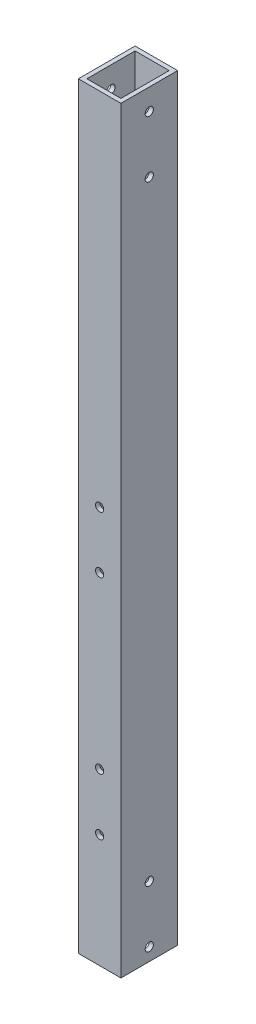
from build123d import *

# Parameters (mm, degrees)
SKETCH_1_W          = 15
SKETCH_1_H          = 20
SKETCH_1_W_2        = 12
SKETCH_1_H_2        = 17
EXTRUDE_1_DEPTH     = 267
SKETCH_4_R          = 1.45
CUT_EXTRUDE_2_DEPTH = 268.607922155
SKETCH_5_R          = 1.45
CUT_EXTRUDE_3_DEPTH = 268.853038064


with BuildPart() as part:
    # 草图1 → 拉伸-薄壁1 (new body)
    with BuildSketch(Plane(origin=(0, 0, 0), x_dir=(1, 0, 0), z_dir=(0, 1, 0))):
        Rectangle(SKETCH_1_W, SKETCH_1_H)
        Rectangle(SKETCH_1_W_2, SKETCH_1_H_2, mode=Mode.SUBTRACT)
    extrude(amount=EXTRUDE_1_DEPTH)

    # 草图4 → 切除-拉伸2 (cut, through all)
    with BuildSketch(Plane(origin=(7.5, 0, 0), x_dir=(0, 0, -1), z_dir=(1, 0, 0))):
        with Locations((0, 259.5)):
            Circle(SKETCH_4_R)
        with Locations((0, 239.5)):
            Circle(SKETCH_4_R)
        with Locations((0, 24.5)):
            Circle(SKETCH_4_R)
        with Locations((0, 4.5)):
            Circle(SKETCH_4_R)
    extrude(amount=-CUT_EXTRUDE_2_DEPTH, mode=Mode.SUBTRACT)

    # 草图5 → 切除-拉伸3 (cut, through all)
    with BuildSketch(Plane.XY.offset(10)):
        with Locations((0, 40)):
            Circle(SKETCH_5_R)
        with Locations((0, 60)):
            Circle(SKETCH_5_R)
        with Locations((0, 120)):
            Circle(SKETCH_5_R)
        with Locations((0, 140)):
            Circle(SKETCH_5_R)
    extrude(amount=-CUT_EXTRUDE_3_DEPTH, mode=Mode.SUBTRACT)


solid = part.part
